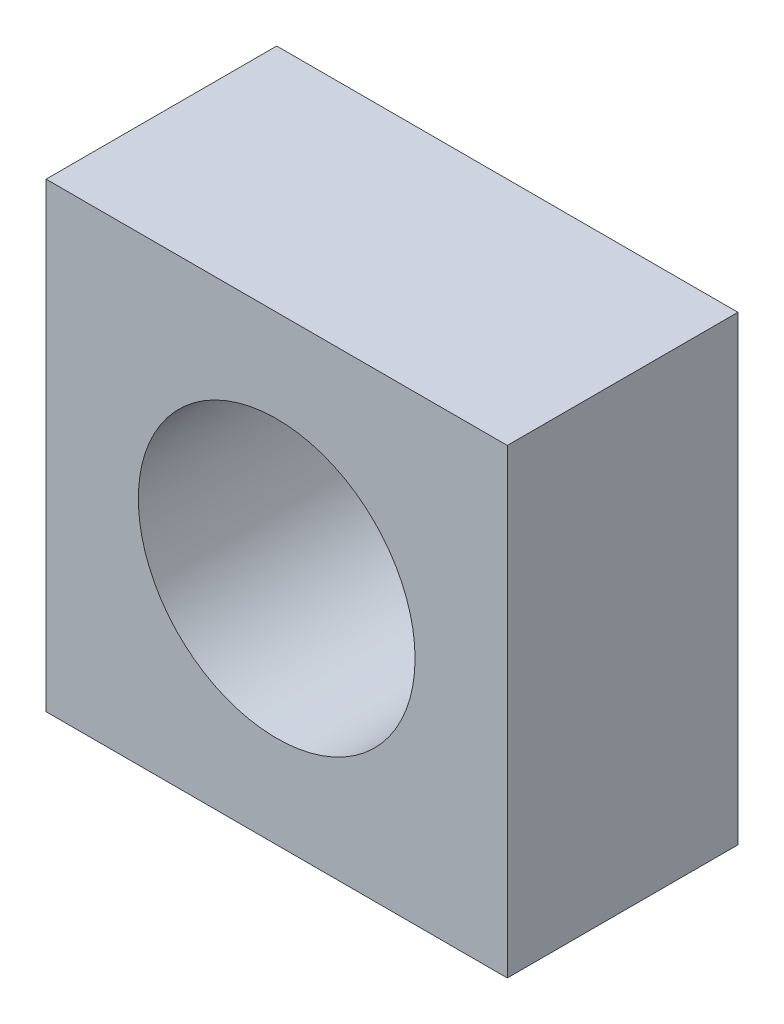
from build123d import *

# Parameters (mm, degrees)
SKETCH1_W           = 5
SKETCH1_H           = 5
SKETCH1_R           = 1.5
BOSS_EXTRUDE1_DEPTH = 2.5


with BuildPart() as part:
    # Sketch1 → Boss-Extrude1 (new body)
    with BuildSketch(Plane.XY):
        Rectangle(SKETCH1_W, SKETCH1_H)
        Circle(SKETCH1_R, mode=Mode.SUBTRACT)
    extrude(amount=BOSS_EXTRUDE1_DEPTH)


solid = part.part
